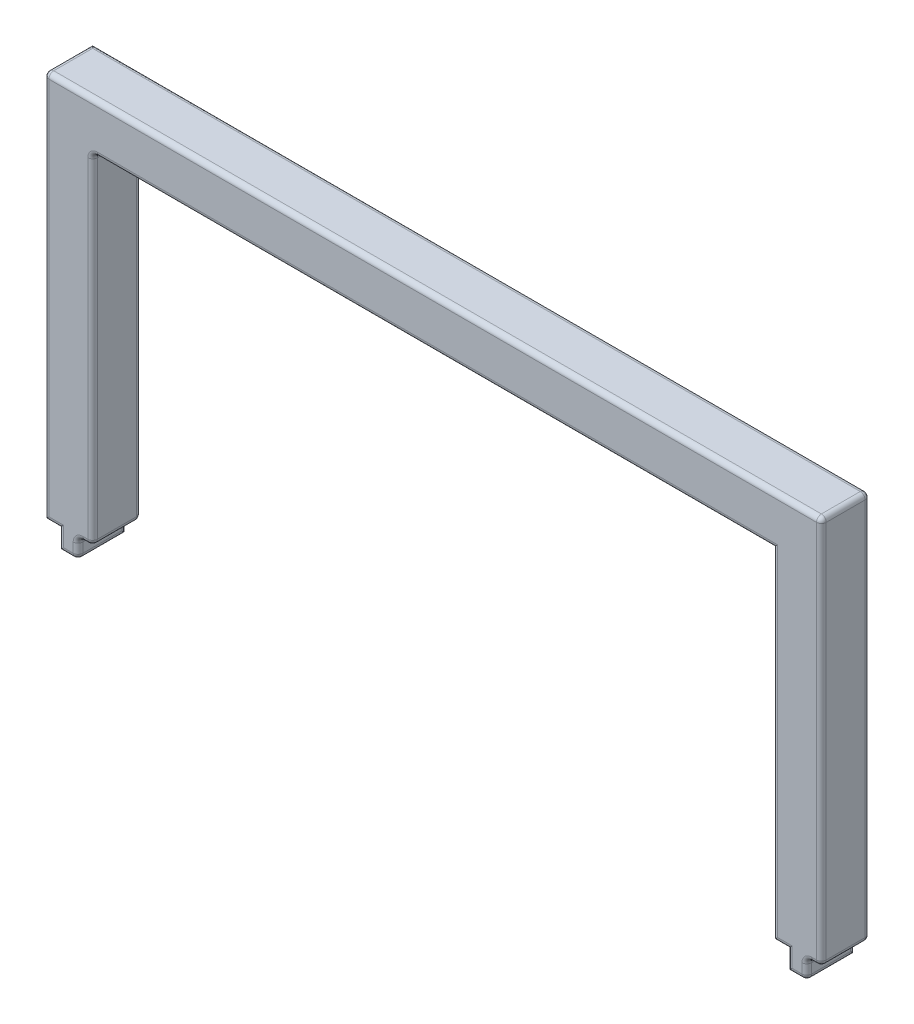
from build123d import *

# Parameters (mm, degrees)
SKETCH1_W           = 2
SKETCH1_H           = 2
BOSS_EXTRUDE1_DEPTH = 5
FILLET1_R           = 0.5


with BuildPart() as part:
    # Sketch1 → Boss-Extrude1 (new body)
    with BuildSketch(Plane.XY):
        Polygon((265.633757962, -112.866242038), (185.633757962, -112.866242038), (185.633757962, -152.866242038), (187.133757962, -152.866242038), (189.133757962, -152.866242038), (190.633757962, -152.866242038), (190.633757962, -117.866242038), (260.633757962, -117.866242038), (260.633757962, -152.866242038), (262.133757962, -152.866242038), (264.133757962, -152.866242038), (265.633757962, -152.866242038), align=None)
        with Locations((188.133757962, -153.866242038)):
            Rectangle(SKETCH1_W, SKETCH1_H)
        with Locations((263.133757962, -153.866242038)):
            Rectangle(SKETCH1_W, SKETCH1_H)
    extrude(amount=BOSS_EXTRUDE1_DEPTH)

    # Fillet1
    fillet1_edges = [part.edges().sort_by_distance(p)[0] for p in [
        (262.133757962, -153.866242038, 5),
        (225.633757962, -117.866242038, 0),
        (190.633757962, -135.366242038, 0),
        (263.133757962, -154.866242038, 5),
        (189.883757962, -152.866242038, 0),
        (189.133757962, -153.866242038, 0),
        (225.633757962, -112.866242038, 0),
        (265.633757962, -132.866242038, 0),
        (264.133757962, -153.866242038, 5),
        (264.883757962, -152.866242038, 0),
        (264.133757962, -153.866242038, 0),
        (264.883757962, -152.866242038, 5),
        (265.633757962, -132.866242038, 5),
        (190.633757962, -117.866242038, 2.5),
        (190.633757962, -152.866242038, 2.5),
        (189.133757962, -152.866242038, 2.5),
        (189.133757962, -154.866242038, 2.5),
        (185.633757962, -112.866242038, 2.5),
        (265.633757962, -112.866242038, 2.5),
        (265.633757962, -152.866242038, 2.5),
        (264.133757962, -152.866242038, 2.5),
        (264.133757962, -154.866242038, 2.5),
        (225.633757962, -112.866242038, 5),
        (185.633757962, -132.866242038, 5),
        (260.633757962, -135.366242038, 5),
        (186.383757962, -152.866242038, 5),
        (187.133757962, -153.866242038, 5),
        (188.133757962, -154.866242038, 5),
        (189.133757962, -153.866242038, 5),
        (189.883757962, -152.866242038, 5),
        (190.633757962, -135.366242038, 5),
        (225.633757962, -117.866242038, 5),
        (261.383757962, -152.866242038, 5),
    ]]
    fillet(fillet1_edges, radius=FILLET1_R)


solid = part.part
